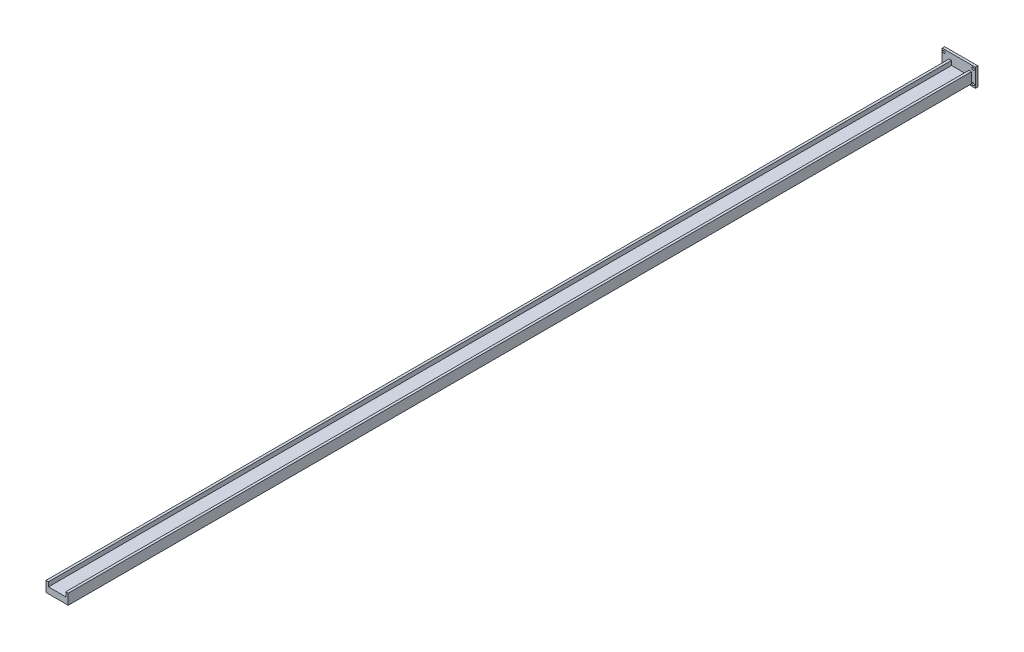
from build123d import *

# Parameters (mm, degrees)
BOSS_EXTRUDE1_DEPTH = 1828
SKETCH2_W           = 67.392754287
SKETCH2_H           = 36.940615493
SKETCH2_R           = 2.5
BOSS_EXTRUDE2_DEPTH = 5


with BuildPart() as part:
    # Sketch1 → Boss-Extrude1 (new body)
    with BuildSketch(Plane.XY):
        Polygon((-20.987492455, 6.600745666), (-15.987492455, 6.600745666), (-15.987492455, -2.358820079), (19.012507545, -2.358820079), (19.012507545, 6.600745666), (24.012507545, 6.600745666), (24.012507545, -14.726832534), (-20.987492455, -14.726832534), align=None)
    extrude(amount=BOSS_EXTRUDE1_DEPTH)

    # Sketch2 → Boss-Extrude2 (add)
    with BuildSketch(Plane(origin=(0, 0, 0), x_dir=(-1, 0, 0), z_dir=(0, 0, -1))):
        with Locations((1.099137048, 0.254222391)):
            Rectangle(SKETCH2_W, SKETCH2_H)
        with Locations((-27.597240096, 13.724530137)):
            Circle(SKETCH2_R, mode=Mode.SUBTRACT)
        with Locations((31.565303785, 13.724530137)):
            Circle(SKETCH2_R, mode=Mode.SUBTRACT)
        with Locations((31.414421828, -13.216085356)):
            Circle(SKETCH2_R, mode=Mode.SUBTRACT)
        with Locations((-27.748122053, -13.216085356)):
            Circle(SKETCH2_R, mode=Mode.SUBTRACT)
    extrude(amount=BOSS_EXTRUDE2_DEPTH)


solid = part.part
